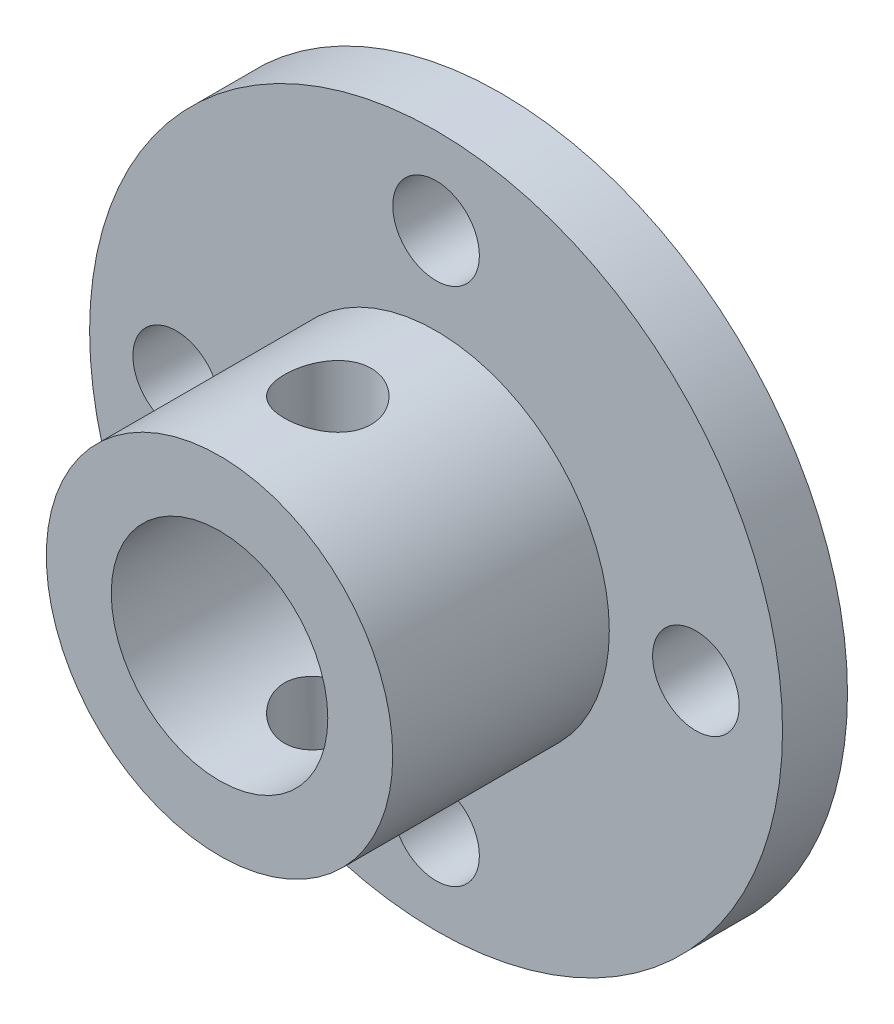
from build123d import *

# Parameters (mm, degrees)
SKETCH_2_R               = 16
SKETCH_2_R_2             = 5
SKETCH_2_R_3             = 2
EXTRUDE_1_DEPTH          = 3
SKETCH_3_R               = 8
SKETCH_3_R_2             = 5
EXTRUDE_2_DEPTH          = 10
CUT_EXTRUDE_1_DEPTH      = 10
CUT_EXTRUDE_1_DEPTH_BACK = 10
SKETCH_4_R               = 2


with BuildPart() as part:
    # 草图2 → 凸台-拉伸1 (new body)
    with BuildSketch(Plane.XY):
        Circle(SKETCH_2_R)
        Circle(SKETCH_2_R_2, mode=Mode.SUBTRACT)
        with Locations((0, -12)):
            Circle(SKETCH_2_R_3, mode=Mode.SUBTRACT)
        with Locations((-12, 0)):
            Circle(SKETCH_2_R_3, mode=Mode.SUBTRACT)
        with Locations((0, 12)):
            Circle(SKETCH_2_R_3, mode=Mode.SUBTRACT)
        with Locations((12, 0)):
            Circle(SKETCH_2_R_3, mode=Mode.SUBTRACT)
    extrude(amount=EXTRUDE_1_DEPTH)

    # 草图3 → 凸台-拉伸2 (add)
    with BuildSketch(Plane.XY.offset(3)):
        Circle(SKETCH_3_R)
        Circle(SKETCH_3_R_2, mode=Mode.SUBTRACT)
    extrude(amount=EXTRUDE_2_DEPTH)

    # 草图4 → 切除-拉伸1 (cut, two sides: drawn at the far end of the back side and taken through both)
    with BuildSketch(Plane(origin=(0, 0, 0), x_dir=(1, 0, 0), z_dir=(0, 1, 0)).offset(-CUT_EXTRUDE_1_DEPTH_BACK)):
        with Locations((0, -8)):
            Circle(SKETCH_4_R)
    extrude(amount=CUT_EXTRUDE_1_DEPTH + CUT_EXTRUDE_1_DEPTH_BACK, mode=Mode.SUBTRACT)


solid = part.part
